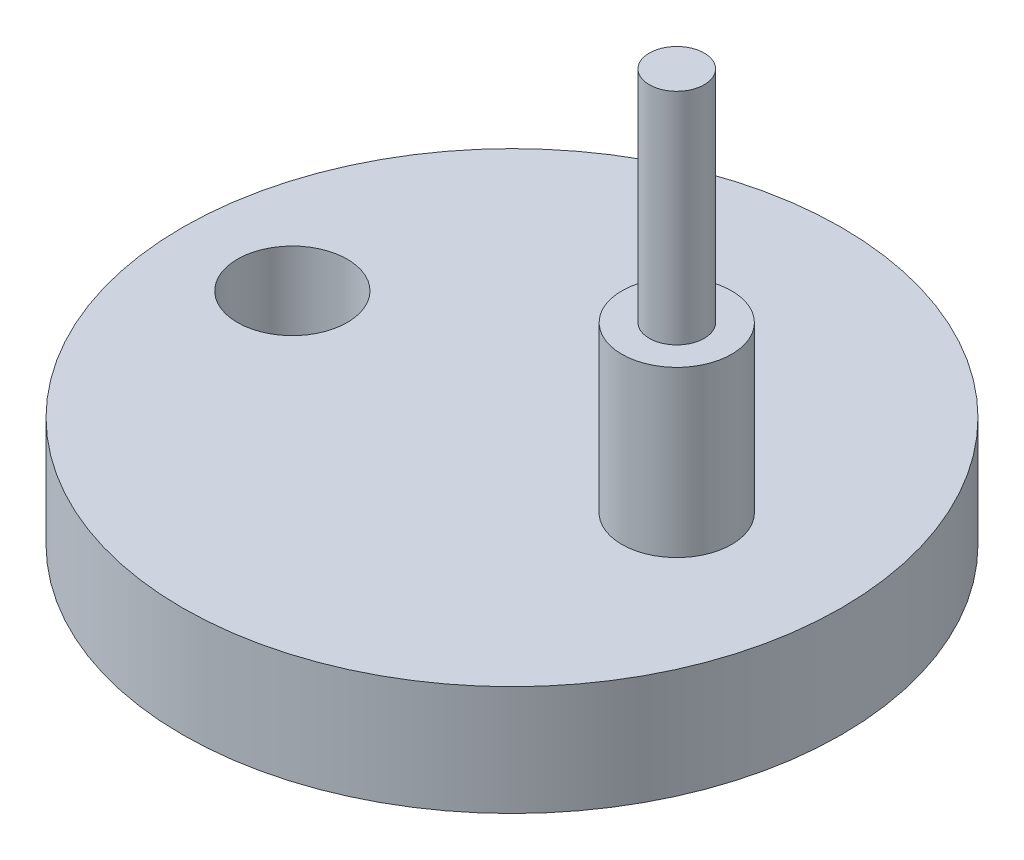
from build123d import *

# Parameters (mm, degrees)
SKETCH_1_R          = 30
EXTRUDE_1_DEPTH     = 10
SKETCH_2_R          = 5
EXTRUDE_2_DEPTH     = 15
SKETCH_3_R          = 2.5
EXTRUDE_3_DEPTH     = 20
SKETCH_5_R          = 5
CUT_EXTRUDE_2_DEPTH = 100


with BuildPart() as part:
    # 스케치1 → 보스-돌출1 (new body)
    with BuildSketch(Plane(origin=(0, 0, 0), x_dir=(1, 0, 0), z_dir=(0, 1, 0))):
        with Locations(Location((0, 0, 0), (0, 0, 270))):
            Circle(SKETCH_1_R)
    extrude(amount=EXTRUDE_1_DEPTH)

    # 스케치2 → 보스-돌출2 (add)
    with BuildSketch(Plane(origin=(0, 10, 0), x_dir=(1, 0, 0), z_dir=(0, 1, 0))):
        with Locations(Location((15, 0, 0), (0, 0, 270))):
            Circle(SKETCH_2_R)
    extrude(amount=EXTRUDE_2_DEPTH)

    # 스케치3 → 보스-돌출3 (add)
    with BuildSketch(Plane(origin=(0, 25, 0), x_dir=(1, 0, 0), z_dir=(0, 1, 0))):
        with Locations(Location((15, 0, 0), (0, 0, 270))):
            Circle(SKETCH_3_R)
    extrude(amount=EXTRUDE_3_DEPTH)

    # 스케치5 → 컷-돌출2 (cut)
    with BuildSketch(Plane(origin=(0, 10, 0), x_dir=(1, 0, 0), z_dir=(0, 1, 0))):
        with Locations(Location((-20, 0, 0), (0, 0, 270))):
            Circle(SKETCH_5_R)
    extrude(amount=-CUT_EXTRUDE_2_DEPTH, mode=Mode.SUBTRACT)


solid = part.part
